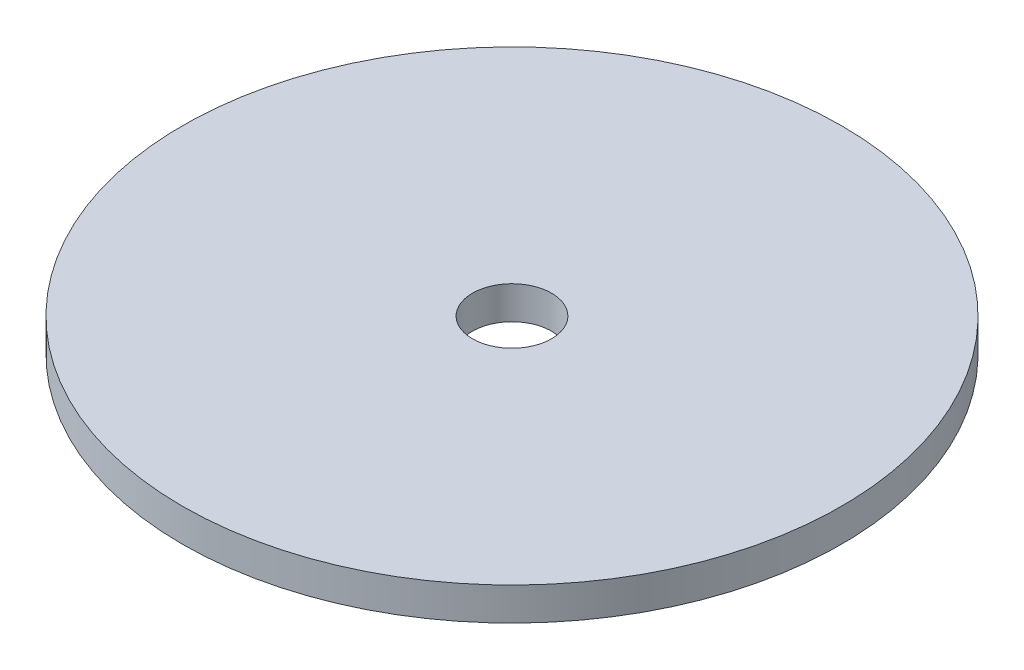
from build123d import *

# Parameters (mm, degrees)
SKETCH1_R           = 50
SKETCH1_R_2         = 6
BOSS_EXTRUDE1_DEPTH = 5


with BuildPart() as part:
    # Sketch1 → Boss-Extrude1 (new body)
    with BuildSketch(Plane(origin=(0, 0, 0), x_dir=(1, 0, 0), z_dir=(0, 1, 0))):
        with Locations(Location((0, 0, 0), (0, 0, 270))):
            Circle(SKETCH1_R)
        with Locations(Location((0, 0, 0), (0, 0, 270))):
            Circle(SKETCH1_R_2, mode=Mode.SUBTRACT)
    extrude(amount=BOSS_EXTRUDE1_DEPTH)


solid = part.part
